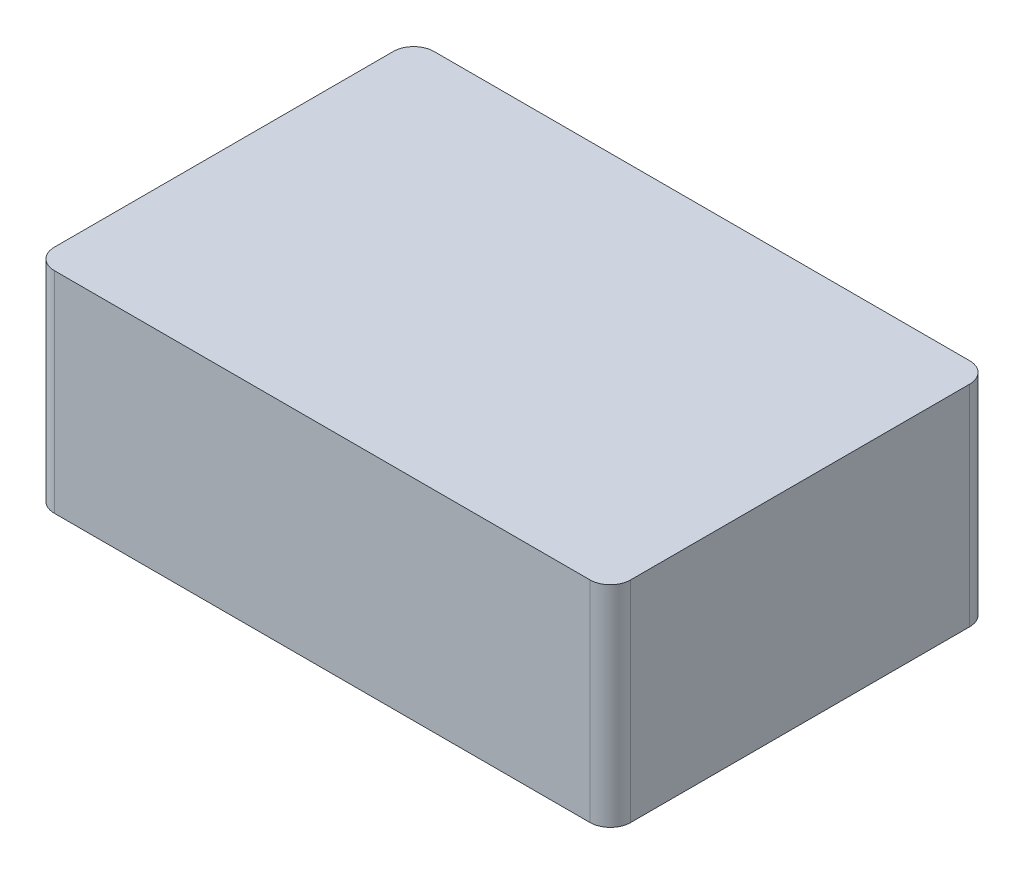
from build123d import *

# Parameters (mm, degrees)
SKETCH1_W           = 85
SKETCH1_H           = 56
BOSS_EXTRUDE1_DEPTH = 31
FILLET1_R           = 3


with BuildPart() as part:
    # Sketch1 → Boss-Extrude1 (new body)
    with BuildSketch(Plane(origin=(0, 0, 0), x_dir=(1, 0, 0), z_dir=(0, 1, 0))):
        with Locations((42.5, -28)):
            Rectangle(SKETCH1_W, SKETCH1_H)
    extrude(amount=BOSS_EXTRUDE1_DEPTH)

    # Fillet1
    fillet1_edges = [part.edges().sort_by_distance(p)[0] for p in [
        (0, 15.5, 0),
        (85, 15.5, 0),
        (85, 15.5, 56),
        (0, 15.5, 56),
    ]]
    fillet(fillet1_edges, radius=FILLET1_R)


solid = part.part
